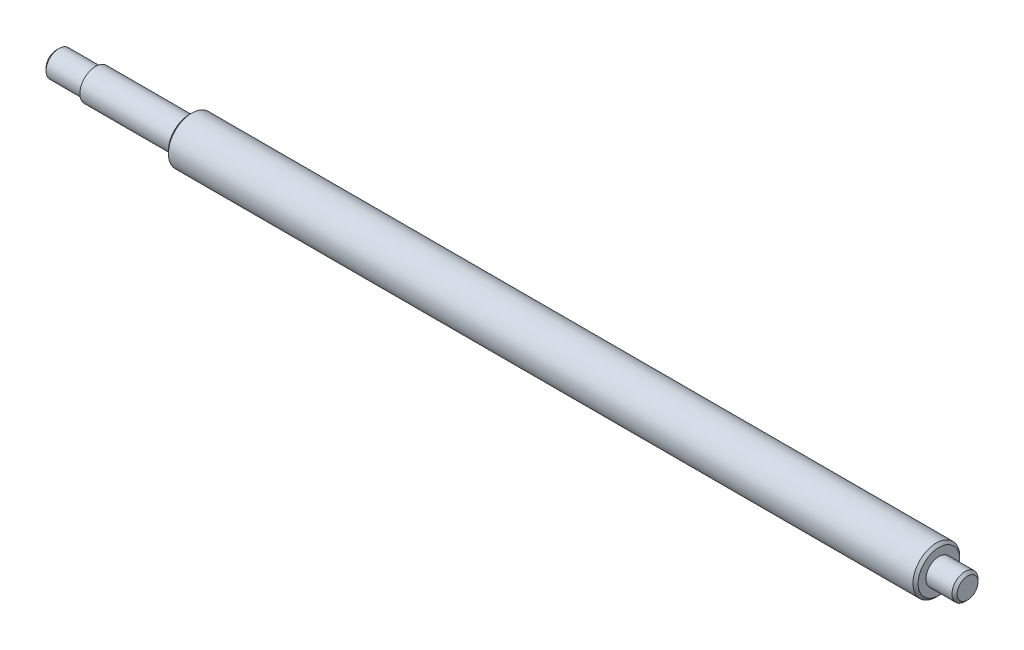
from build123d import *


with BuildPart() as part:
    # Sketch1 → Revolve1 (revolve)
    with BuildSketch(Plane(origin=(0, 0, 0), x_dir=(1, 0, 0), z_dir=(0, 1, 0)), mode=Mode.PRIVATE) as revolve1_sk:
        Polygon((-208.466913465, 0), (-208.466913465, 4), (-207.466913465, 5), (-193.466913465, 5), (-193.466913465, 6), (-157.466913465, 6), (-157.466913465, 8), (-156.466913465, 9), (129.533086535, 9), (130.533086535, 8), (130.533086535, 5), (140.533086535, 5), (141.533086535, 4), (141.533086535, 0), align=None)
    revolve(revolve1_sk.sketch.rotate(Axis((-222.96414574, 0, 0), (1, 0, 0)), 180), axis=Axis((-222.96414574, 0, 0), (1, 0, 0)))


solid = part.part
